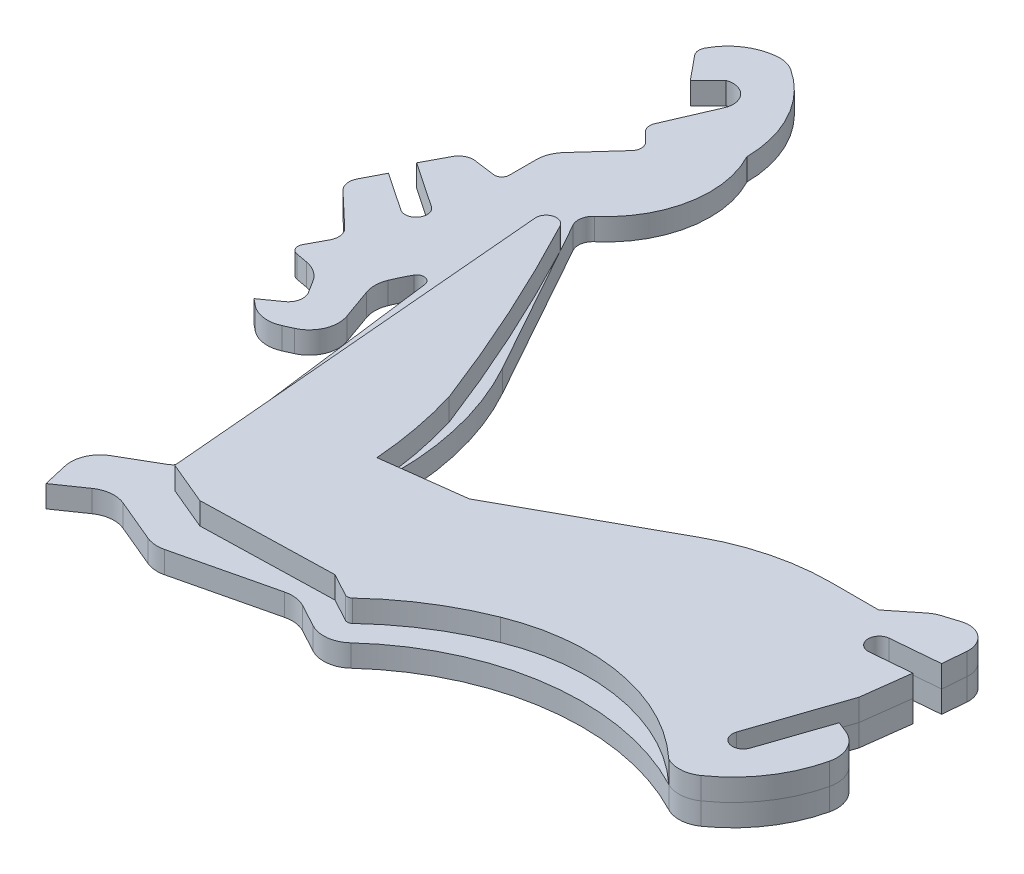
from build123d import *

# Parameters (mm, degrees)
BOSS_EXTRUDE2_DEPTH = 3
FILLET1_R           = 1
FILLET2_R           = 4
FILLET3_R           = 40
FILLET4_R           = 2
FILLET5_R           = 1.4
FILLET6_R           = 30
FILLET7_R           = 3
BOSS_EXTRUDE3_DEPTH = 3


with BuildPart() as part:
    # Sketch4 → Boss-Extrude2 (new body)
    with BuildSketch(Plane(origin=(0, 0, 0), x_dir=(1, 0, 0), z_dir=(0, 1, 0))):
        with BuildLine():
            Line((87.31, 79.61), (91.618486592, 77.887634392))
            ThreePointArc((91.618486592, 77.887634392), (88.863922918, 68.889748023), (81.855760182, 62.61))
            ThreePointArc((81.855760182, 62.61), (59.656820918, 67.258748235), (39.555721251, 56.754008505))
            Line((39.555721251, 56.754008505), (32.499176634, 60.570465889))
            Line((32.499176634, 60.570465889), (16.517315238, 56.754008505))
            Line((16.517315238, 56.754008505), (7.414760931, 60.570465889))
            Line((7.414760931, 60.570465889), (1.892511031, 56.754008505))
            Line((1.892511031, 56.754008505), (0.46321022, 62.992365596))
            Line((0.46321022, 62.992365596), (9.066007765, 67.967785451))
            Line((9.066007765, 67.967785451), (3.879350061, 108.84040305))
            ThreePointArc((3.879350061, 108.84040305), (2.01611376, 105.85998951), (0.66321022, 102.615892348))
            Line((0.66321022, 102.615892348), (3.879350061, 93.591357519))
            Line((3.879350061, 93.591357519), (-2.93678978, 90.505813501))
            Line((-2.93678978, 90.505813501), (-5.768910997, 92.808331559))
            Line((-5.768910997, 92.808331559), (-1.778138145, 95.640627614))
            Line((-1.778138145, 95.640627614), (-4.765318246, 100.408264948))
            Line((-4.765318246, 100.408264948), (-9.496065378, 101.269350579))
            Line((-9.496065378, 101.269350579), (-6.815233616, 106.290541956))
            Line((-6.815233616, 106.290541956), (-13.555482626, 112.676963609))
            Line((-13.555482626, 112.676963609), (-11.418327461, 116.805813501))
            Line((-11.418327461, 116.805813501), (-6.221647651, 113.305813501))
            ThreePointArc((-6.221647651, 113.305813501), (-4.139581192, 113.712014511), (-4.545782202, 115.79408097))
            Line((-4.545782202, 115.79408097), (-10.724979751, 119.955813501))
            Line((-10.724979751, 119.955813501), (-8.365992616, 124.387469749))
            Line((-8.365992616, 124.387469749), (-2.93678978, 123.666991194))
            Line((-2.93678978, 123.666991194), (-2.93678978, 130.055848545))
            Line((-2.93678978, 130.055848545), (3.413077147, 137.08559026))
            Line((3.413077147, 137.08559026), (0.522809133, 139.95641446))
            Line((0.522809133, 139.95641446), (3.698074275, 147.318161123))
            ThreePointArc((3.698074275, 147.318161123), (3.364070449, 150.092913281), (0.66321022, 150.811357519))
            Line((0.66321022, 150.811357519), (-1.778138145, 148.370009154))
            Line((-1.778138145, 148.370009154), (-4.999762187, 152.301948586))
            ThreePointArc((-4.999762187, 152.301948586), (-1.941119995, 156.054428227), (2.78321022, 157.111357519))
            ThreePointArc((2.78321022, 157.111357519), (8.815996079, 151.282158066), (11.096791577, 143.209237691))
            ThreePointArc((11.096791577, 143.209237691), (12.311774437, 133.113784868), (6.46321022, 124.795813501))
            Line((6.46321022, 124.795813501), (24.42321022, 92.530161433))
            Line((24.42321022, 92.530161433), (24.42321022, 79.395813501))
            Line((24.42321022, 79.395813501), (35.622369927, 80.833234121))
            Line((35.622369927, 80.833234121), (62.451437904, 95.640627614))
            Line((62.451437904, 95.640627614), (76.661791259, 95.640627614))
            Line((76.661791259, 95.640627614), (80.884676882, 99.013707758))
            Line((80.884676882, 99.013707758), (87.938365698, 101.231357519))
            Line((87.938365698, 101.231357519), (87.31, 93.591357519))
            Line((87.31, 93.591357519), (80.722672152, 93.01504101))
            ThreePointArc((80.722672152, 93.01504101), (79.359113719, 91.390015348), (80.984139381, 90.026456915))
            Line((80.984139381, 90.026456915), (86.46321022, 90.505813501))
            Line((86.46321022, 90.505813501), (85.632866314, 84))
            Line((85.632866314, 84), (81.389705108, 71.508585308))
            ThreePointArc((81.389705108, 71.508585308), (82.327545423, 69.605835839), (84.230294892, 70.543676154))
            Line((84.230294892, 70.543676154), (87.31, 79.61))
        make_face()
    extrude(amount=BOSS_EXTRUDE2_DEPTH)

    # Fillet1
    fillet1_edges = [part.edges().sort_by_distance(p)[0] for p in [
        (3.879350061, 1.5, -108.84040305),
        (-9.496065378, 1.5, -101.269350579),
        (-2.93678978, 1.5, -123.666991194),
    ]]
    fillet(fillet1_edges, radius=FILLET1_R)

    # Fillet2
    fillet2_edges = [part.edges().sort_by_distance(p)[0] for p in [
        (39.555721251, 1.5, -56.754008505),
        (32.499176634, 1.5, -60.570465889),
        (16.517315238, 1.5, -56.754008505),
        (7.414760931, 1.5, -60.570465889),
        (0.46321022, 1.5, -62.992365596),
        (0.66321022, 1.5, -102.615892348),
        (3.879350061, 1.5, -93.591357519),
        (-2.93678978, 1.5, -90.505813501),
        (-4.765318246, 1.5, -100.408264948),
        (-2.93678978, 1.5, -130.055848545),
        (2.78321022, 1.5, -157.111357519),
        (80.884676882, 1.5, -99.013707758),
        (91.618486592, 1.5, -77.887634392),
        (81.855760182, 1.5, -62.61),
    ]]
    fillet(fillet2_edges, radius=FILLET2_R)

    # Fillet3
    fillet3_edges = [part.edges().sort_by_distance(p)[0] for p in [
        (24.42321022, 1.5, -92.530161433),
    ]]
    fillet(fillet3_edges, radius=FILLET3_R)

    # Fillet4
    fillet4_edges = [part.edges().sort_by_distance(p)[0] for p in [
        (9.066007765, 1.5, -67.967785451),
        (-1.778138145, 1.5, -95.640627614),
        (-6.815233616, 1.5, -106.290541956),
        (-13.555482626, 1.5, -112.676963609),
        (-8.365992616, 1.5, -124.387469749),
        (6.46321022, 1.5, -124.795813501),
    ]]
    fillet(fillet4_edges, radius=FILLET4_R)

    # Fillet5
    fillet5_edges = [part.edges().sort_by_distance(p)[0] for p in [
        (3.413077147, 1.5, -137.08559026),
        (0.522809133, 1.5, -139.95641446),
        (-4.999762187, 1.5, -152.301948586),
    ]]
    fillet(fillet5_edges, radius=FILLET5_R)

    # Fillet6
    fillet6_edges = [part.edges().sort_by_distance(p)[0] for p in [
        (62.451437904, 1.5, -95.640627614),
    ]]
    fillet(fillet6_edges, radius=FILLET6_R)

    # Fillet7
    fillet7_edges = [part.edges().sort_by_distance(p)[0] for p in [
        (87.938365698, 1.5, -101.231357519),
    ]]
    fillet(fillet7_edges, radius=FILLET7_R)


with BuildPart() as body_2:
    # Sketch5 → Boss-Extrude3 (new body)
    with BuildSketch(Plane(origin=(0, 3, 0), x_dir=(1, 0, 0), z_dir=(0, 1, 0))):
        with BuildLine():
            Line((87.31, 79.61), (84.230294892, 70.543676154))
            ThreePointArc((84.230294892, 70.543676154), (82.327545423, 69.605835839), (81.389705108, 71.508585308))
            Line((81.389705108, 71.508585308), (85.632866314, 84))
            Line((85.632866314, 84), (86.46321022, 90.505813501))
            Line((86.46321022, 90.505813501), (80.984139381, 90.026456915))
            ThreePointArc((80.984139381, 90.026456915), (79.359113719, 91.390015348), (80.722672152, 93.01504101))
            Line((80.722672152, 93.01504101), (87.31, 93.591357519))
            Line((87.31, 93.591357519), (87.572724876, 96.785704468))
            ThreePointArc((87.572724876, 96.785704468), (86.455459348, 99.375377321), (83.683054116, 99.893505658))
            Line((83.683054116, 99.893505658), (81.597540254, 99.23782897))
            ThreePointArc((81.597540254, 99.23782897), (80.917202257, 98.952625765), (80.300808738, 98.54733613))
            Line((80.300808738, 98.54733613), (76.661791259, 95.640627614))
            Line((76.661791259, 95.640627614), (70.18064804, 95.640627614))
            ThreePointArc((70.18064804, 95.640627614), (62.69586156, 94.691926575), (55.684463394, 91.905825704))
            Line((55.684463394, 91.905825704), (35.622369927, 80.833234121))
            Line((35.622369927, 80.833234121), (24.42321022, 79.395813501))
            ThreePointArc((24.42321022, 79.395813501), (23.608754268, 85.518438874), (22.151992942, 91.520748963))
            ThreePointArc((22.151992942, 91.520748963), (16.259725713, 105.585278319), (9.537592469, 119.272598135))
            ThreePointArc((9.537592469, 119.272598135), (7.897389311, 119.964377284), (6.893123557, 118.494589854))
            Line((6.893123557, 118.494589854), (11.522159273, 64.703771757))
            Line((11.522159273, 64.703771757), (17.400375916, 62.239192854))
            Line((17.400375916, 62.239192854), (35.390108767, 62.701811781))
            Line((35.390108767, 62.701811781), (38.486705756, 61.027050112))
            ThreePointArc((38.486705756, 61.027050112), (38.935574107, 60.942421204), (39.350288499, 61.133880915))
            ThreePointArc((39.350288499, 61.133880915), (45.144601659, 65.639230218), (51.683133982, 68.973871489))
            ThreePointArc((51.683133982, 68.973871489), (66.59541671, 70.470238781), (79.961069943, 63.689781208))
            ThreePointArc((79.961069943, 63.689781208), (82.074415622, 63.235042849), (84.115757484, 63.946337682))
            ThreePointArc((84.115757484, 63.946337682), (88.624490915, 68.52513407), (91.181739197, 74.42043175))
            ThreePointArc((91.181739197, 74.42043175), (90.825596234, 77.169883499), (88.767430757, 79.027375787))
            Line((88.767430757, 79.027375787), (87.31, 79.61))
        make_face()
    extrude(amount=BOSS_EXTRUDE3_DEPTH)


solid = Compound([part.part, body_2.part])
